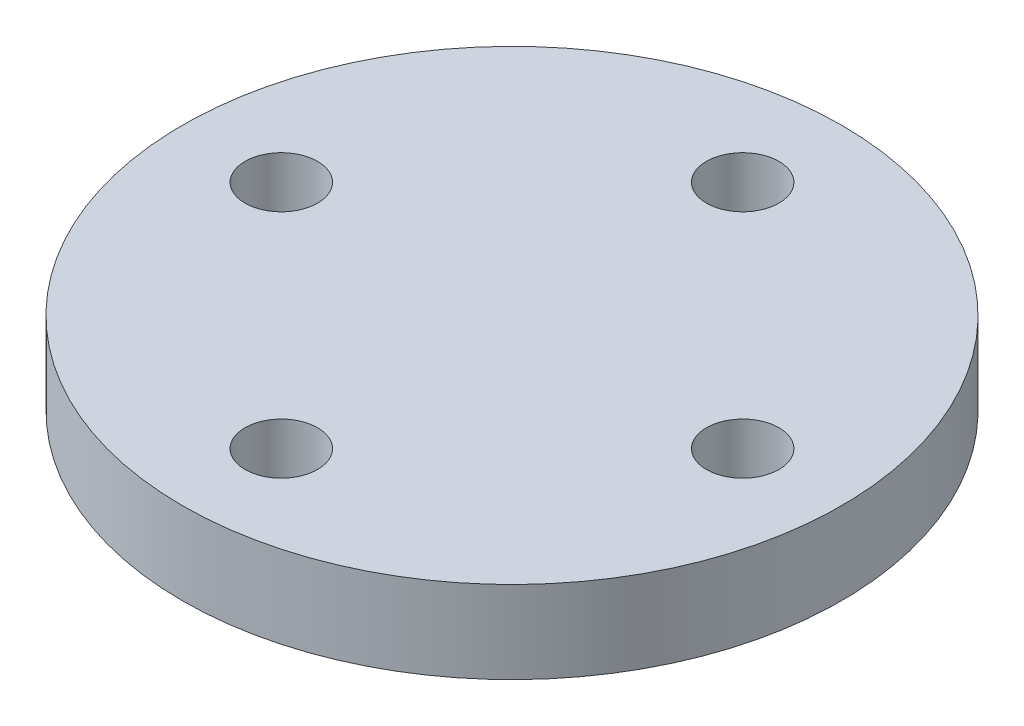
from build123d import *

# Parameters (mm, degrees)
SKETCH1_R           = 10
SKETCH1_R_2         = 1.1
BOSS_EXTRUDE1_DEPTH = 2.5


with BuildPart() as part:
    # Sketch1 → Boss-Extrude1 (new body)
    with BuildSketch(Plane(origin=(0, 0, 0), x_dir=(1, 0, 0), z_dir=(0, 1, 0))):
        with Locations(Location((0, 0, 0), (0, 0, 270))):
            Circle(SKETCH1_R)
        with Locations(Location((0, 7, 0), (0, 0, 270))):
            Circle(SKETCH1_R_2, mode=Mode.SUBTRACT)
        with Locations(Location((7, 0, 0), (0, 0, 270))):
            Circle(SKETCH1_R_2, mode=Mode.SUBTRACT)
        with Locations(Location((0, -7, 0), (0, 0, 270))):
            Circle(SKETCH1_R_2, mode=Mode.SUBTRACT)
        with Locations(Location((-7, 0, 0), (0, 0, 270))):
            Circle(SKETCH1_R_2, mode=Mode.SUBTRACT)
    extrude(amount=BOSS_EXTRUDE1_DEPTH)


solid = part.part
